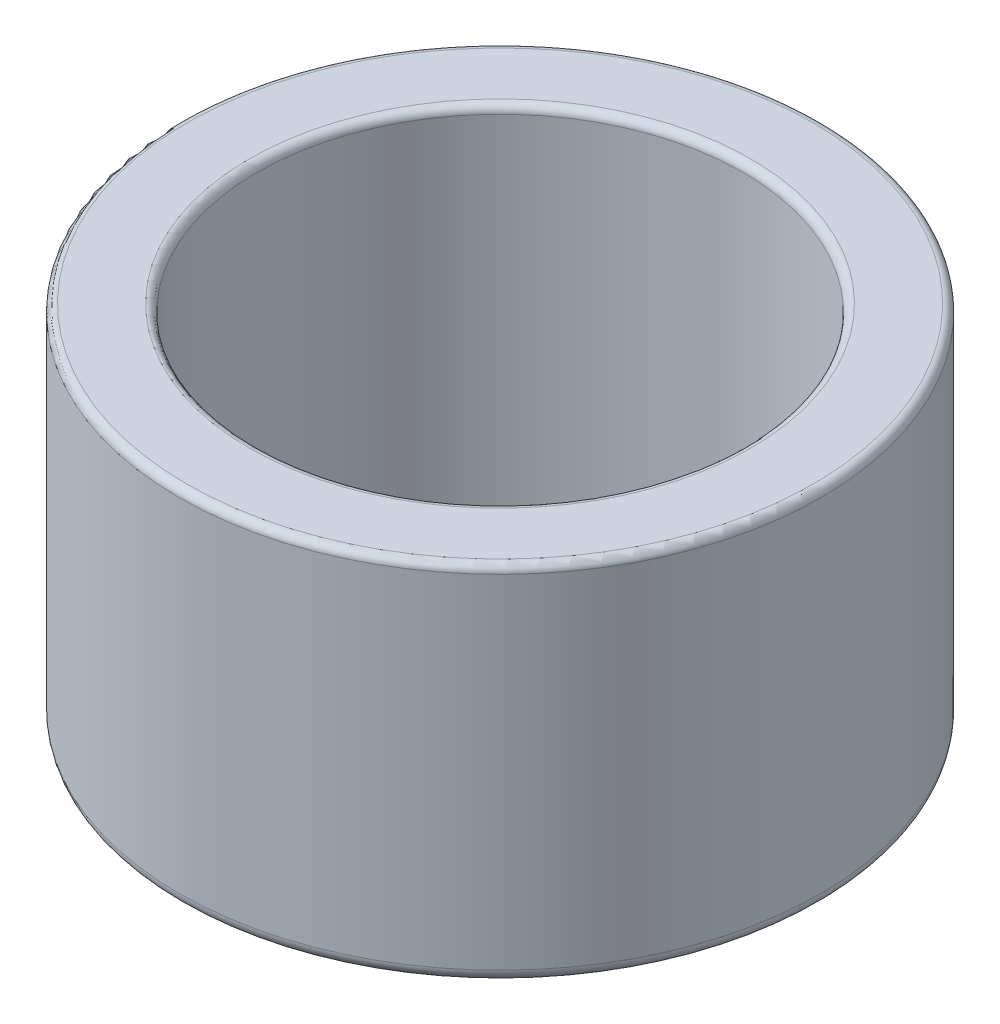
from build123d import *

# Parameters (mm, degrees)
SKETCH1_R           = 12.35035
SKETCH1_R_2         = 9.35035
BOSS_EXTRUDE1_DEPTH = 14
FILLET1_R           = 0.3
FILLET5_R           = 0.3
FILLET6_R           = 0.5
FILLET7_R           = 0.5


with BuildPart() as part:
    # Sketch1 → Boss-Extrude1 (new body)
    with BuildSketch(Plane(origin=(0, 0, 0), x_dir=(1, 0, 0), z_dir=(0, 1, 0))):
        with Locations(Location((0, 0, 0), (0, 0, 270))):
            Circle(SKETCH1_R)
        with Locations(Location((0, 0, 0), (0, 0, 270))):
            Circle(SKETCH1_R_2, mode=Mode.SUBTRACT)
    extrude(amount=BOSS_EXTRUDE1_DEPTH)

    # Fillet1
    fillet1_edges = [part.edges().sort_by_distance(p)[0] for p in [
        (0, 14, -12.35035),
    ]]
    fillet(fillet1_edges, radius=FILLET1_R)

    # Fillet5
    fillet5_edges = [part.edges().sort_by_distance(p)[0] for p in [
        (0, 14, -9.35035),
    ]]
    fillet(fillet5_edges, radius=FILLET5_R)

    # Fillet6
    fillet6_edges = [part.edges().sort_by_distance(p)[0] for p in [
        (0, 0, -12.35035),
    ]]
    fillet(fillet6_edges, radius=FILLET6_R)

    # Fillet7
    fillet7_edges = [part.edges().sort_by_distance(p)[0] for p in [
        (0, 0, -9.35035),
    ]]
    fillet(fillet7_edges, radius=FILLET7_R)


solid = part.part
